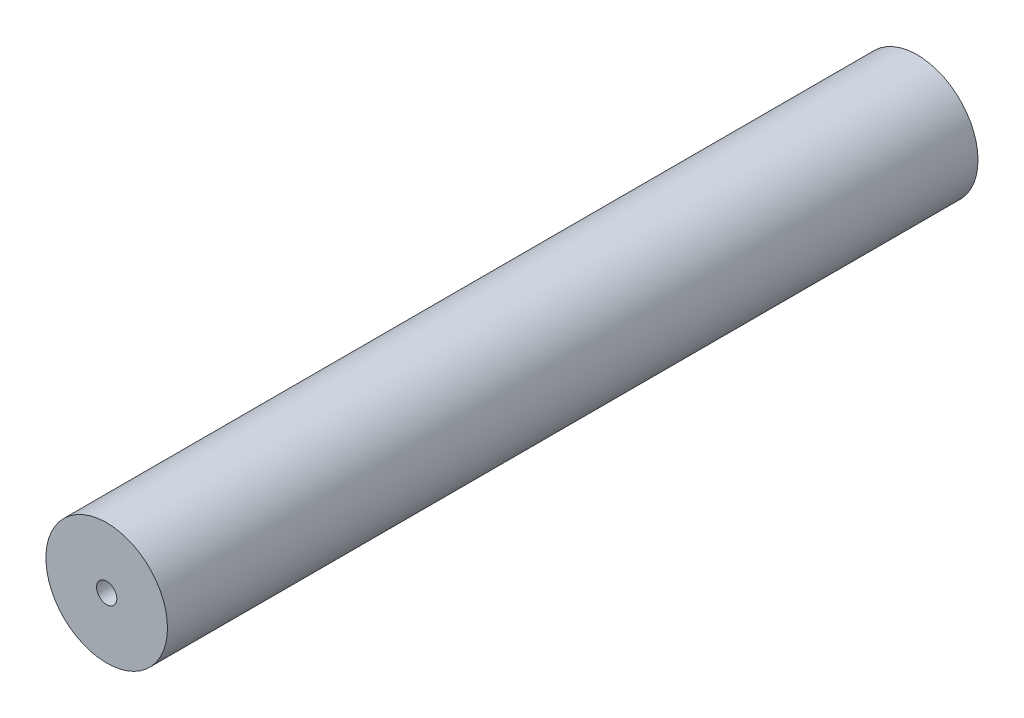
from build123d import *

# Parameters (mm, degrees)
SKETCH1_R           = 38.1
SKETCH1_R_2         = 6.35
BOSS_EXTRUDE1_DEPTH = 508


with BuildPart() as part:
    # Sketch1 → Boss-Extrude1 (new body)
    with BuildSketch(Plane.XY):
        Circle(SKETCH1_R)
        Circle(SKETCH1_R_2, mode=Mode.SUBTRACT)
    extrude(amount=BOSS_EXTRUDE1_DEPTH)


solid = part.part
